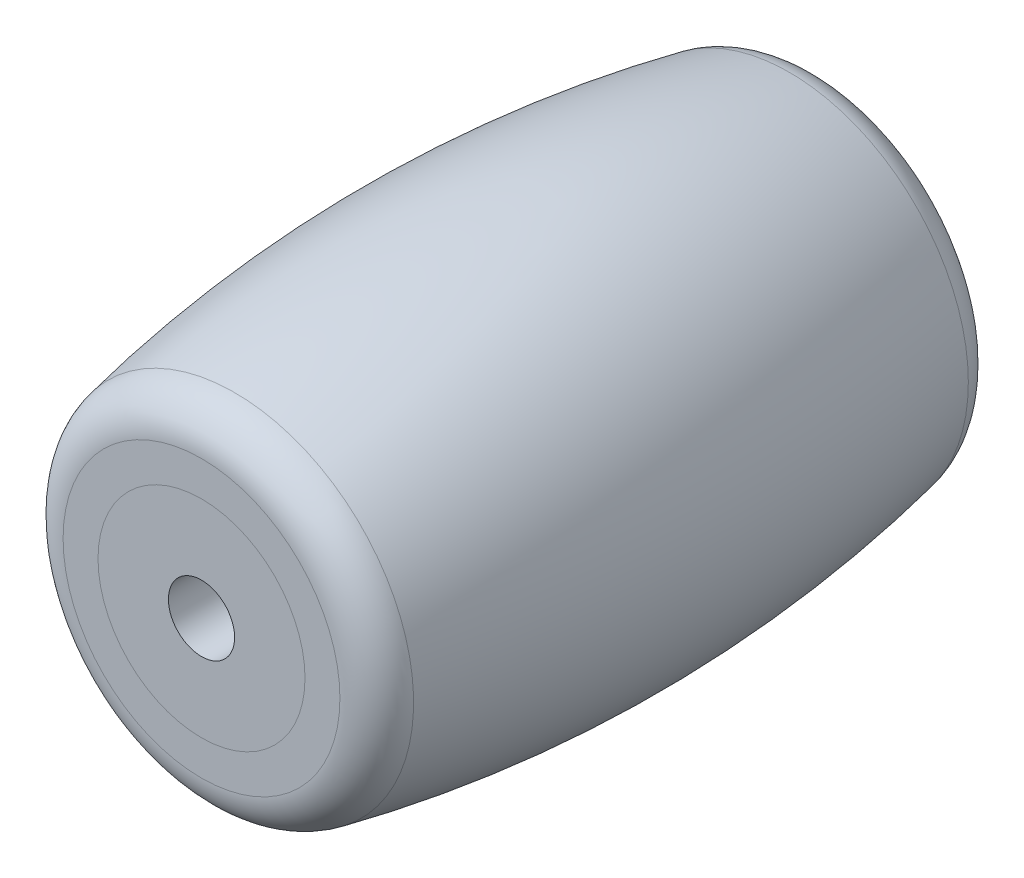
from build123d import *

# Parameters (mm, degrees)
VERRUNDUNG1_R                        = 2
AUFSATZ_LINEAR_AUSTRAGEN1_DEPTH      = 15
AUFSATZ_LINEAR_AUSTRAGEN1_DEPTH_BACK = 15
SKIZZE2_R                            = 5
SKIZZE2_R_2                          = 1.6


with BuildPart() as part:
    # Skizze1 → Rotation1 (revolve)
    with BuildSketch(Plane(origin=(0, 0, 0), x_dir=(0, 0, -1), z_dir=(1, 0, 0)), mode=Mode.PRIVATE) as rotation1_sk:
        with BuildLine():
            Line((-15, 5), (15, 5))
            Line((15, 5), (15, 8.299310869))
            ThreePointArc((15, 8.299310869), (0, 10), (-15, 8.299310869))
            Line((-15, 8.299310869), (-15, 5))
        make_face()
    revolve(rotation1_sk.sketch.rotate(Axis((0, 0, 18.551269556), (0, 0, -1)), 90), axis=Axis((0, 0, 18.551269556), (0, 0, -1)))

    # Verrundung1
    verrundung1_edges = [part.edges().sort_by_distance(p)[0] for p in [
        (-8.299310869, 0, 15),
        (-8.299310869, 0, -15),
    ]]
    fillet(verrundung1_edges, radius=VERRUNDUNG1_R)


with BuildPart() as body_2:
    # Skizze2 → Aufsatz-Linear austragen1 (new, two sides: drawn at the far end of the back side and taken through both)
    with BuildSketch(Plane.XY.offset(-AUFSATZ_LINEAR_AUSTRAGEN1_DEPTH_BACK)):
        Circle(SKIZZE2_R)
        Circle(SKIZZE2_R_2, mode=Mode.SUBTRACT)
    extrude(amount=AUFSATZ_LINEAR_AUSTRAGEN1_DEPTH + AUFSATZ_LINEAR_AUSTRAGEN1_DEPTH_BACK)


solid = Compound([part.part, body_2.part])
